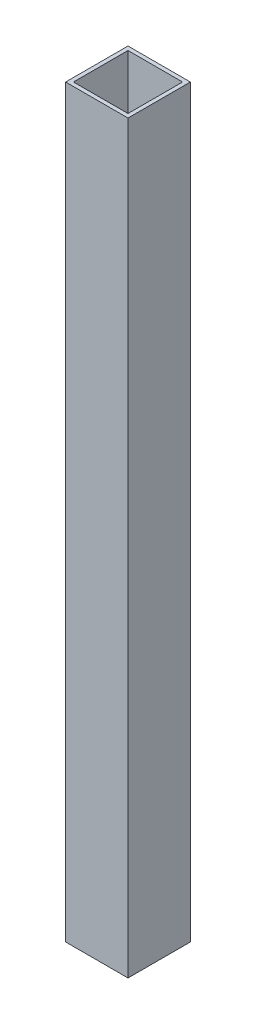
from build123d import *

# Parameters (mm, degrees)
CROQUIS1_W              = 76.2
CROQUIS1_H              = 76.2
CROQUIS1_W_2            = 66.675
CROQUIS1_H_2            = 66.675
SALIENTE_EXTRUIR1_DEPTH = 910


with BuildPart() as part:
    # Croquis1 → Saliente-Extruir1 (new body)
    with BuildSketch(Plane(origin=(0, 0, 0), x_dir=(1, 0, 0), z_dir=(0, 1, 0))):
        with Locations((38.1, -38.1)):
            Rectangle(CROQUIS1_W, CROQUIS1_H)
        with Locations((38.1, -38.1)):
            Rectangle(CROQUIS1_W_2, CROQUIS1_H_2, mode=Mode.SUBTRACT)
    extrude(amount=SALIENTE_EXTRUIR1_DEPTH)


solid = part.part
